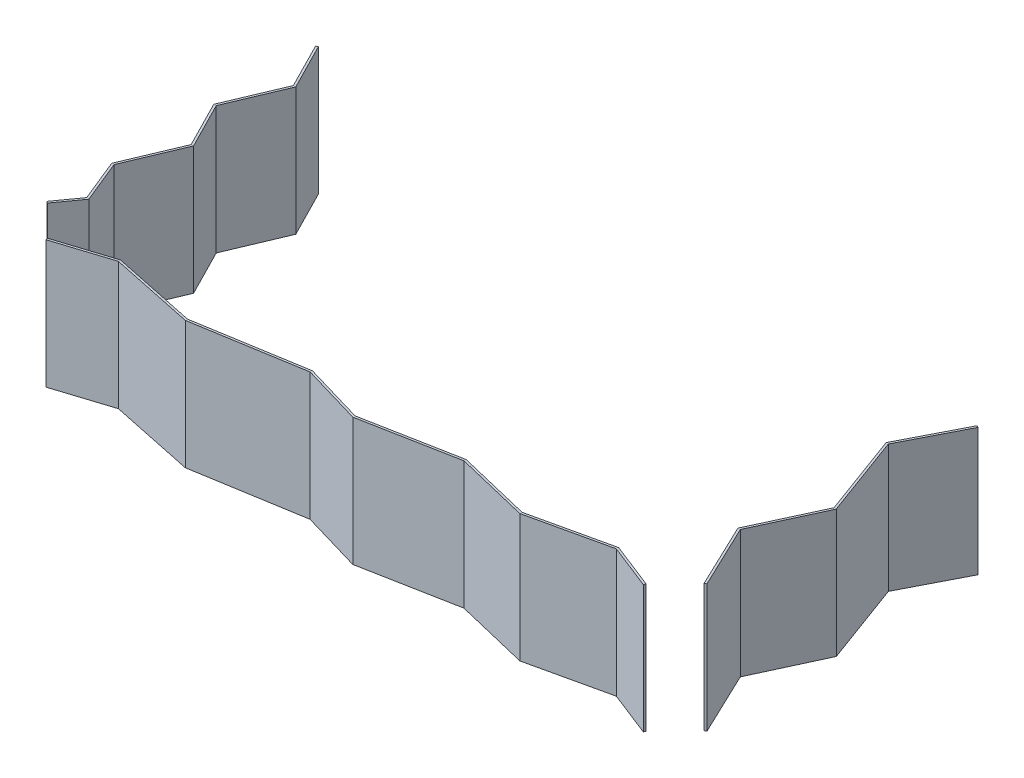
from build123d import *

# Parameters (mm, degrees)
EXTRUDE_THIN10_START   = 0.47614
EXTRUDE_THIN10_DEPTH   = 3
EXTRUDE_THIN10_2_DEPTH = 3
EXTRUDE_THIN10_3_DEPTH = 3


with BuildPart() as part:
    # Sketch1 → Extrude-Thin10 (new body)
    with BuildSketch(Plane(origin=(0, 0, 0), x_dir=(1, 0, 0), z_dir=(0, 1, 0)).offset(EXTRUDE_THIN10_START)):
        Polygon((-5.344998837, 2.923194647), (-4.791238449, 1.836977847), (-5.344998837, 0.520996496), (-4.791238449, -0.565220304), (-5.344998837, -1.881201656), (-4.937600398, -2.880557356), (-5.344998837, -3.446805239), (-5.385585749, -3.417604168), (-4.994344658, -2.873813573), (-5.399117596, -1.880898273), (-4.846333276, -0.567236492), (-5.400093664, 0.518980307), (-4.846333276, 1.834961659), (-5.389544097, 2.900485183), align=None)
    extrude(amount=-EXTRUDE_THIN10_DEPTH)


with BuildPart() as body_2:
    # Sketch1 → Extrude-Thin10 2 (new body)
    with BuildSketch(Plane(origin=(0, 0, 0), x_dir=(1, 0, 0), z_dir=(0, 1, 0)).offset(EXTRUDE_THIN10_START)):
        Polygon((-4.629998684, -4.16180563), (-3.327453045, -3.745803105), (-1.336770496, -4.162457592), (1.181674404, -3.745803105), (2.602406923, -4.162457592), (4.794817652, -3.745803105), (6.526832136, -4.162457592), (8.379823695, -3.745803105), (9.440000534, -4.16180563), (9.421736763, -4.208350604), (8.375833249, -3.797948787), (6.526449725, -4.213791989), (4.793583387, -3.796932579), (2.599901518, -4.213828639), (1.17856535, -3.796997121), (-1.337848026, -4.213315511), (-3.324796084, -3.797442661), (-4.614786837, -4.209435449), align=None)
    extrude(amount=-EXTRUDE_THIN10_2_DEPTH)


with BuildPart() as body_3:
    # Sketch1 → Extrude-Thin10 3 (new body)
    with BuildSketch(Plane(origin=(0, 0, 0), x_dir=(1, 0, 0), z_dir=(0, 1, 0)).offset(EXTRUDE_THIN10_START)):
        Polygon((10.155000687, 2.923194647), (9.440000534, 1.530846994), (10.152701275, -0.405525353), (9.440000534, -1.948419986), (10.155000687, -3.446805239), (10.109875016, -3.468338327), (9.384764432, -1.948765215), (10.098625013, -0.403359694), (9.385498872, 1.534168444), (10.110522476, 2.946035155), align=None)
    extrude(amount=-EXTRUDE_THIN10_3_DEPTH)


solid = Compound([part.part, body_2.part, body_3.part])
